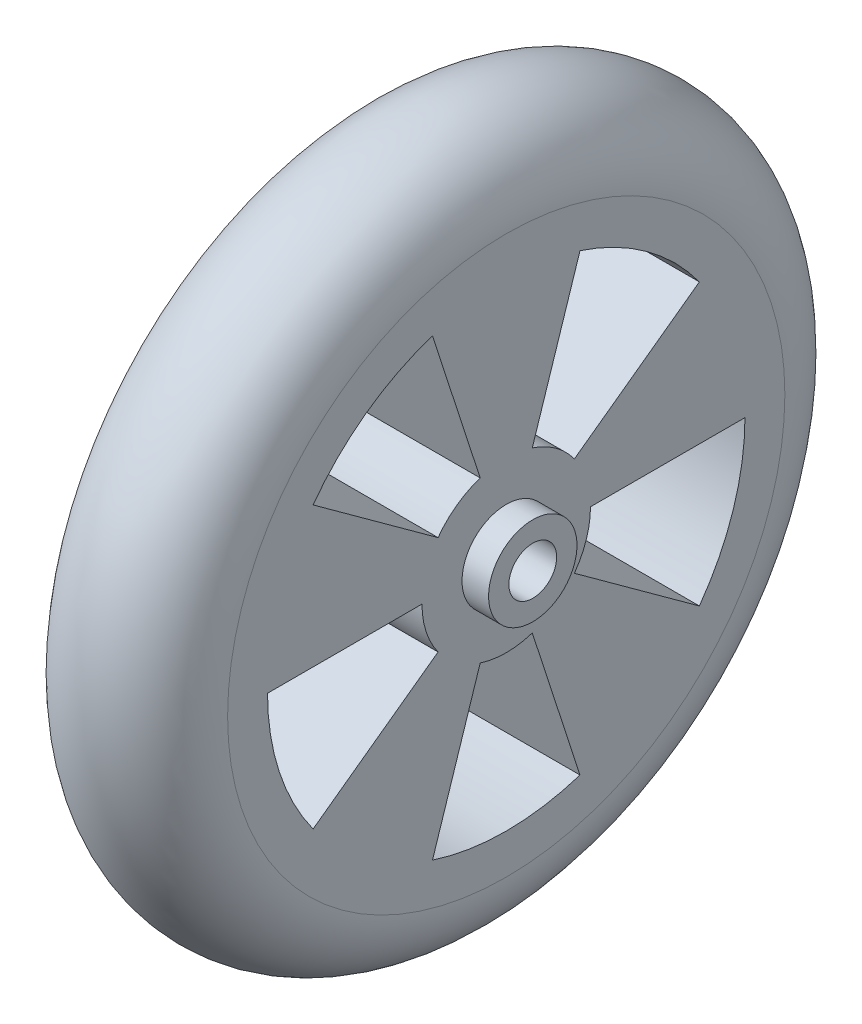
from build123d import *

# Parameters (mm, degrees)
SKETCH2_R          = 2.7
CUT_EXTRUDE1_DEPTH = 61.000000133
CUT_EXTRUDE2_DEPTH = 61.000000133


with BuildPart() as part:
    # Sketch1 → Revolve1 (revolve)
    with BuildSketch(Plane.XY, mode=Mode.PRIVATE) as revolve1_sk:
        with BuildLine():
            Line((0, 31.5), (0, 0))
            Line((0, 0), (20, 0))
            Line((20, 0), (20, 5))
            Line((20, 5), (17, 5))
            Line((17, 5), (17, 31.5))
            ThreePointArc((17, 31.5), (8.5, 40), (0, 31.5))
        make_face()
    revolve(revolve1_sk.sketch.rotate(Axis((0, 0, 0), (1, 0, 0)), 90), axis=Axis((0, 0, 0), (1, 0, 0)))

    # Sketch2 → Cut-Extrude1 (cut, through all)
    with BuildSketch(Plane(origin=(0, 0, 0), x_dir=(0, 0, -1), z_dir=(1, 0, 0))):
        Circle(SKETCH2_R)
    extrude(amount=CUT_EXTRUDE1_DEPTH, mode=Mode.SUBTRACT)

    # Sketch3 → Cut-Extrude2 (cut, through all)
    with BuildSketch(Plane(origin=(0, 0, 0), x_dir=(0, 0, -1), z_dir=(1, 0, 0))):
        with BuildLine():
            Line((-21.833346136, 15.862854496), (-7.705886871, 5.598654528))
            ThreePointArc((-7.705886871, 5.598654528), (-5.598654528, 7.705886871), (-2.943386871, 9.058813318))
            Line((-2.943386871, 9.058813318), (-8.339596136, 25.666637734))
            ThreePointArc((-8.339596136, 25.666637734), (-15.862854496, 21.833346136), (-21.833346136, 15.862854496))
        make_face()
        with BuildLine():
            Line((8.339596136, 25.666637734), (2.943386871, 9.058813318))
            ThreePointArc((2.943386871, 9.058813318), (5.598654528, 7.705886871), (7.705886871, 5.598654528))
            Line((7.705886871, 5.598654528), (21.833346136, 15.862854496))
            ThreePointArc((21.833346136, 15.862854496), (15.862854496, 21.833346136), (8.339596136, 25.666637734))
        make_face()
        with BuildLine():
            Line((26.9875, 0), (9.525, 0))
            ThreePointArc((9.525, 0), (9.058813318, -2.943386871), (7.705886871, -5.598654528))
            Line((7.705886871, -5.598654528), (21.833346136, -15.862854496))
            ThreePointArc((21.833346136, -15.862854496), (25.666637734, -8.339596136), (26.9875, 0))
        make_face()
        with BuildLine():
            Line((8.339596136, -25.666637734), (2.943386871, -9.058813318))
            ThreePointArc((2.943386871, -9.058813318), (0, -9.525), (-2.943386871, -9.058813318))
            Line((-2.943386871, -9.058813318), (-8.339596136, -25.666637734))
            ThreePointArc((-8.339596136, -25.666637734), (0, -26.9875), (8.339596136, -25.666637734))
        make_face()
        with BuildLine():
            Line((-21.833346136, -15.862854496), (-7.705886871, -5.598654528))
            ThreePointArc((-7.705886871, -5.598654528), (-9.058813318, -2.943386871), (-9.525, 0))
            Line((-9.525, 0), (-26.9875, 0))
            ThreePointArc((-26.9875, 0), (-25.666637734, -8.339596136), (-21.833346136, -15.862854496))
        make_face()
    extrude(amount=CUT_EXTRUDE2_DEPTH, mode=Mode.SUBTRACT)


solid = part.part
